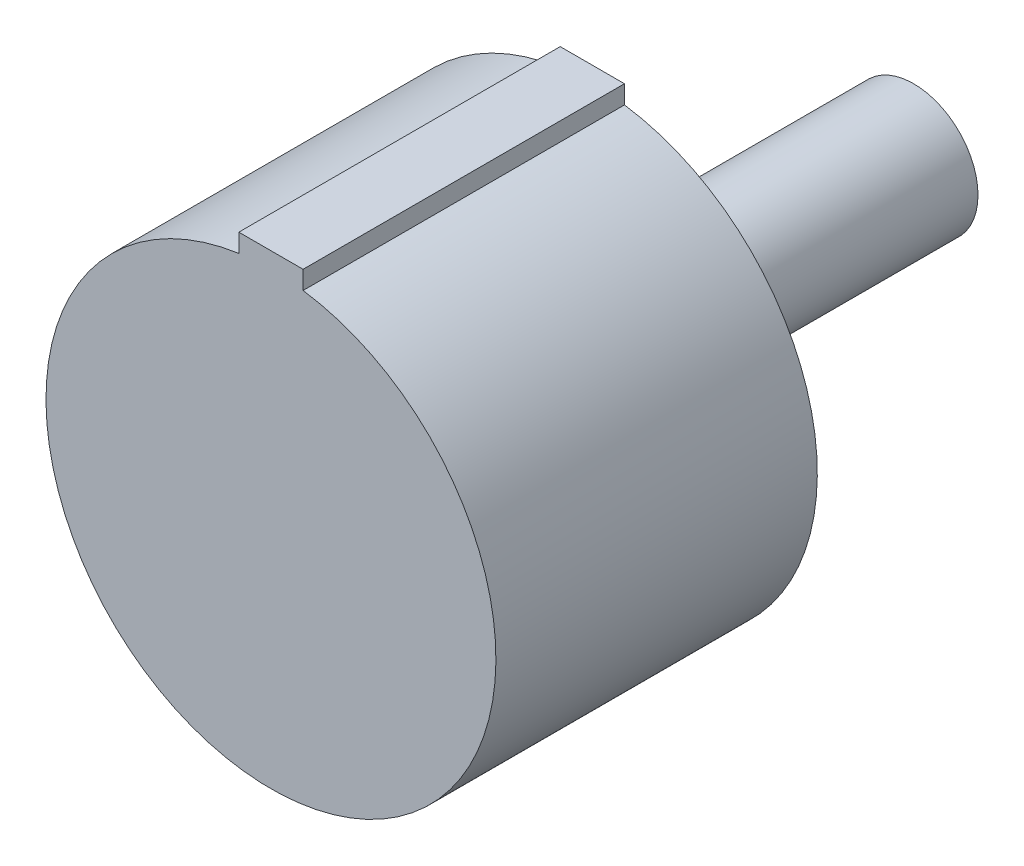
from build123d import *

# Parameters (mm, degrees)
SKETCH1_R           = 4
BOSS_EXTRUDE1_DEPTH = 40
BOSS_EXTRUDE2_DEPTH = 20


with BuildPart() as part:
    # Sketch1 → Boss-Extrude1 (new body)
    with BuildSketch(Plane.XY):
        Circle(SKETCH1_R)
    extrude(amount=BOSS_EXTRUDE1_DEPTH)

    # Sketch2 → Boss-Extrude2 (add)
    with BuildSketch(Plane.XY.offset(40)):
        with BuildLine():
            Line((-2, 13.856406461), (-2, 15))
            Line((-2, 15), (2, 15))
            Line((2, 15), (2, 13.856406461))
            ThreePointArc((2, 13.856406461), (0, -14), (-2, 13.856406461))
        make_face()
    extrude(amount=-BOSS_EXTRUDE2_DEPTH)


solid = part.part
